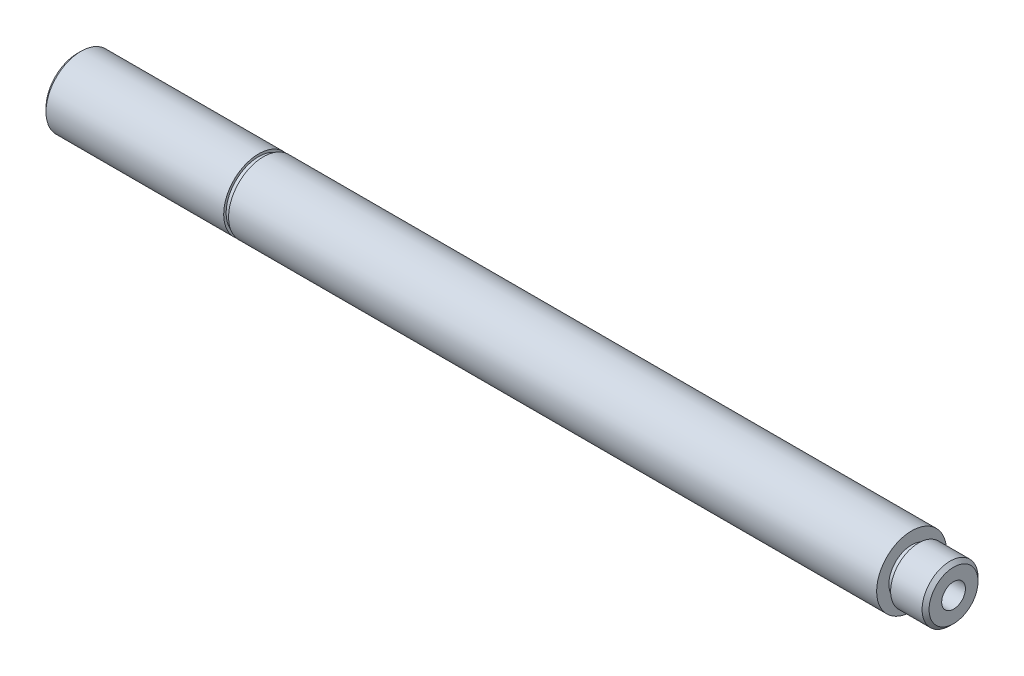
from build123d import *

# Parameters (mm, degrees)
M10X1_52_D            = 8.5
M10X1_52_DEPTH        = 37.5
M10X1_52_CSINK_D      = 11
M10X1_52_CSINK_ANGLE  = 90
M10X1_52_TIP          = 2.553657631
HOLE_WIZARD_M81_D     = 6.8
HOLE_WIZARD_M81_DEPTH = 20
HOLE_WIZARD_M81_TIP   = 2.042926105
SKETCH_6_W            = 2
SKETCH_6_H            = 1.5
SKETCH_20_W           = 1.4
SKETCH_20_H           = 0.7
CHAMFER_1_SIZE        = 1


with BuildPart() as part:
    # Эскиз1 → Повернуть1 (revolve)
    with BuildSketch(Plane.XY, mode=Mode.PRIVATE) as revolve_1_sk:
        Polygon((0, 10), (238.5, 10), (238.5, 8), (250.5, 8), (250.5, 0), (0, 0), align=None)
    revolve(revolve_1_sk.sketch.rotate(Axis((-123.335902371, 0, 0), (1, 0, 0)), 90), axis=Axis((-123.335902371, 0, 0), (1, 0, 0)))

    # Отверстие обработанное метчиком M10x1.52
    with Locations(Plane.ZY):
        with Locations((0, 0)):
            CounterSinkHole(M10X1_52_D / 2, M10X1_52_CSINK_D / 2, depth=M10X1_52_DEPTH, counter_sink_angle=M10X1_52_CSINK_ANGLE)
            with Locations((0, 0, -(M10X1_52_DEPTH + M10X1_52_TIP / 2))):  # 118° drill point
                Cone(0, M10X1_52_D / 2, M10X1_52_TIP, mode=Mode.SUBTRACT)

    # Отверстие обработанное метчиком M81
    with Locations(Plane(origin=(250.5, 0, 0), x_dir=(0, 0, -1), z_dir=(1, 0, 0))):
        with Locations((0, 0)):
            Hole(HOLE_WIZARD_M81_D / 2, depth=HOLE_WIZARD_M81_DEPTH)
            with Locations((0, 0, -(HOLE_WIZARD_M81_DEPTH + HOLE_WIZARD_M81_TIP / 2))):  # 118° drill point
                Cone(0, HOLE_WIZARD_M81_D / 2, HOLE_WIZARD_M81_TIP, mode=Mode.SUBTRACT)

    # Эскиз6 → Вырез-Повернуть1 (revolve, cut)
    with BuildSketch(Plane.XY, mode=Mode.PRIVATE) as cut_revolve_1_sk:
        with Locations((239.5, 7.25)):
            Rectangle(SKETCH_6_W, SKETCH_6_H)
    revolve(cut_revolve_1_sk.sketch.rotate(Axis((0, 0, 0), (1, 0, 0)), 90), axis=Axis((0, 0, 0), (1, 0, 0)), mode=Mode.SUBTRACT)

    # Эскиз20 → Вырез-Повернуть2 (revolve, cut)
    with BuildSketch(Plane.XY, mode=Mode.PRIVATE) as cut_revolve_2_sk:
        with Locations((52.5, 9.65)):
            Rectangle(SKETCH_20_W, SKETCH_20_H)
    revolve(cut_revolve_2_sk.sketch.rotate(Axis((0, 0, 0), (1, 0, 0)), 90), axis=Axis((0, 0, 0), (1, 0, 0)), mode=Mode.SUBTRACT)

    # Фаска1
    chamfer_1_edges = [part.edges().sort_by_distance(p)[0] for p in [
        (250.5, 0, -8),
        (0, 0, -10),
    ]]
    chamfer(chamfer_1_edges, length=CHAMFER_1_SIZE)


solid = part.part
